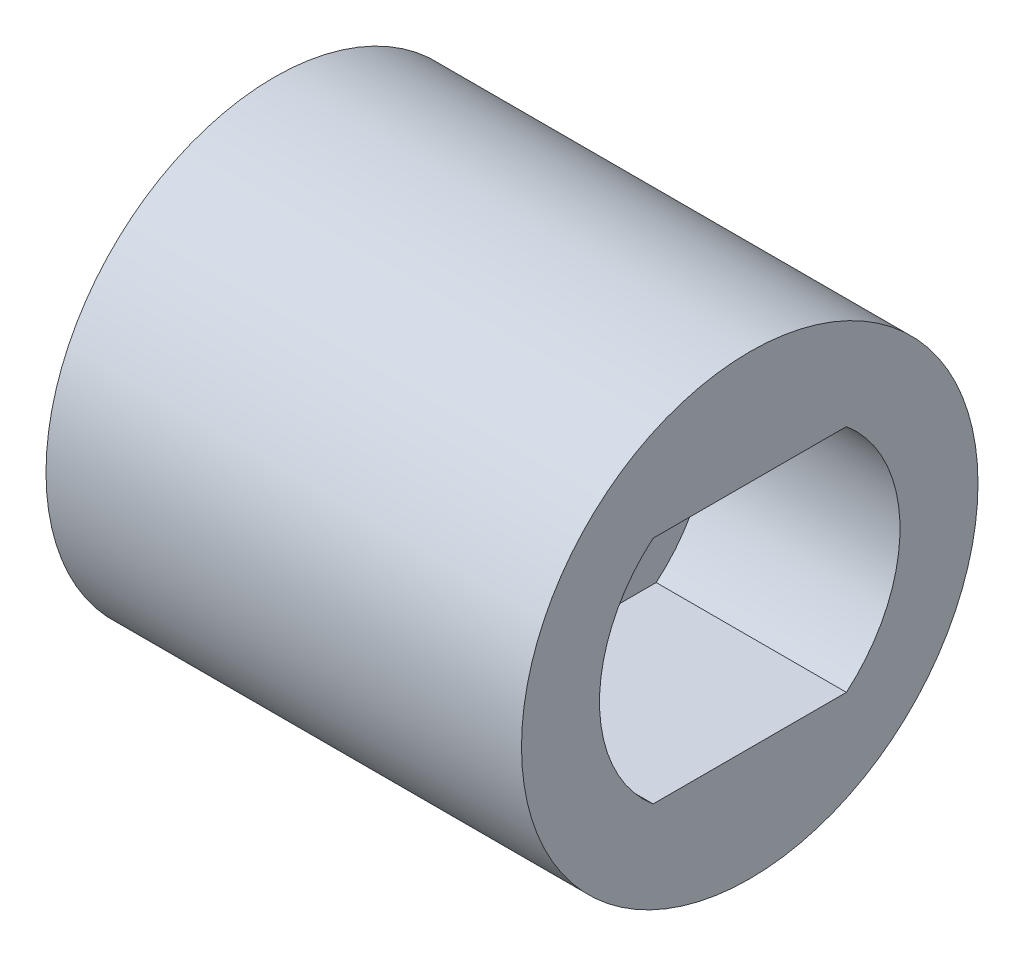
from build123d import *

# Parameters (mm, degrees)
BASPROSKE_W         = 14
BASPROSKE_H         = 2.25
TOOTHCUT_DEPTH      = 23
TEETHCUTS_COUNT     = 41
TEETHCUTS_ANGLE     = 351.219512195
EXTRUDE_START       = 11
SKETCH_1_R          = 12
SKETCH_1_R_2        = 4
EXTRUDE_1_DEPTH     = 11
CUT_EXTRUDE_1_REACH = 25
CUT_EXTRUDE_START   = 1
SKETCH_1_3_R        = 4


with BuildPart() as part:
    # BasProSke → Base-Revolve (revolve)
    with BuildSketch(Plane(origin=(0, 0, 0), x_dir=(1, 0, 0), z_dir=(0, 1, 0))):
        with Locations((7, 10.875)):
            Rectangle(BASPROSKE_W, BASPROSKE_H)
    revolve(axis=Axis((-10, 0, 0), (1, 0, 0)))

    # TooCutSke → ToothCut (cut, through all)
    with BuildSketch(Plane(origin=(0, 0, 0), x_dir=(0, 0, -1), z_dir=(1, 0, 0))):
        with BuildLine():
            ThreePointArc((0.61773312, 9.704960121), (0.414250651, 10.304883928), (0.13830881, 10.875120536))
            ThreePointArc((0.13830881, 10.875120536), (0, 10.876), (-0.13830881, 10.875120536))
            ThreePointArc((-0.13830881, 10.875120536), (-0.414250651, 10.304883928), (-0.61773312, 9.704960121))
            ThreePointArc((-0.61773312, 9.704960121), (0, 9.7246), (0.61773312, 9.704960121))
        make_face()
    toothcut = extrude(amount=TOOTHCUT_DEPTH, mode=Mode.SUBTRACT)

    # TeethCuts: ToothCut ×41 about axis
    teethcuts_axis = Axis((-10, 0, 0), (1, 0, 0))
    for i in range(1, TEETHCUTS_COUNT):
        add(toothcut.rotate(teethcuts_axis, i * TEETHCUTS_ANGLE / (TEETHCUTS_COUNT - 1)), mode=Mode.SUBTRACT)

    # 草图1 → 凸台-拉伸1 (add)
    with BuildSketch(Plane(origin=(14, 0, 0), x_dir=(0, 0, -1), z_dir=(1, 0, 0)).offset(EXTRUDE_START)):
        Circle(SKETCH_1_R)
        Circle(SKETCH_1_R_2, mode=Mode.SUBTRACT)
    extrude(amount=-EXTRUDE_1_DEPTH)

    # 草图1<3> → 切除-拉伸1 (cut, up to next)
    with BuildSketch(Plane(origin=(14, 0, 0), x_dir=(0, 0, -1), z_dir=(1, 0, 0)).offset(CUT_EXTRUDE_START), mode=Mode.PRIVATE) as cut_extrude_1_sk1:
        with BuildLine():
            ThreePointArc((-7.9, 5e-09), (-7.160406949, -3.337449974), (-5.080108267, -6.05))
            Line((-5.080108267, -6.05), (5.080108267, -6.05))
            ThreePointArc((5.080108267, -6.05), (7.160406947, -3.337449977), (7.9, 0))
            ThreePointArc((7.9, 0), (7.160406947, 3.337449977), (5.080108267, 6.05))
            Line((5.080108267, 6.05), (-5.080108267, 6.05))
            ThreePointArc((-5.080108267, 6.05), (-7.160406946, 3.337449979), (-7.9, 5e-09))
        make_face()
        Circle(SKETCH_1_3_R, mode=Mode.SUBTRACT)
    cut_extrude_1_tool1 = extrude(cut_extrude_1_sk1.sketch, amount=CUT_EXTRUDE_1_REACH, mode=Mode.PRIVATE) & part.part
    add(cut_extrude_1_tool1.solids().sort_by_distance((15, 3.253376, 6.980028))[0], mode=Mode.SUBTRACT)


solid = part.part
